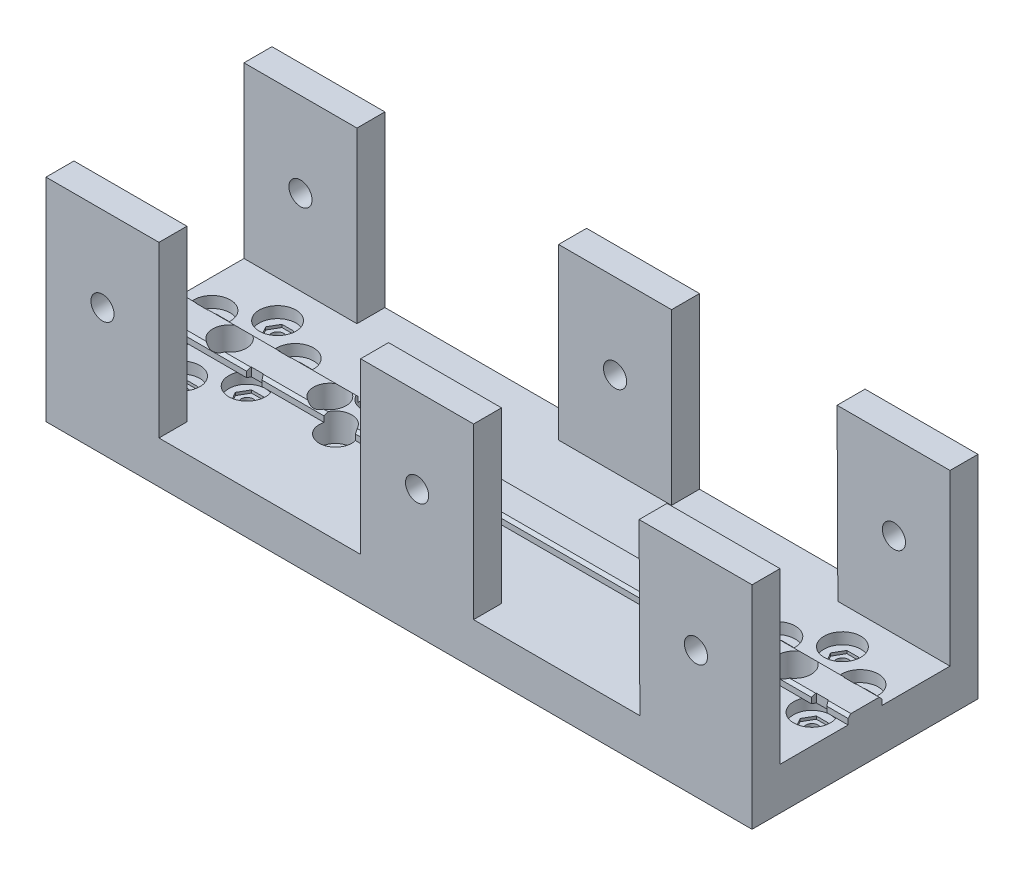
from build123d import *

# Parameters (mm, degrees)
SKETCH1_W                = 250
SKETCH1_H                = 60
SKETCH1_R                = 2.2
BOSS_EXTRUDE1_DEPTH      = 15
BOSS_EXTRUDE2_START      = 15
SKETCH2_W                = 250
SKETCH2_H                = 12
BOSS_EXTRUDE2_DEPTH      = 3
CHAMFER1_SIZE            = 1
CUT_EXTRUDE1_START       = 18
CUT_EXTRUDE1_DEPTH       = 8
CUT_EXTRUDE2_START       = 15
SKETCH4_R                = 6.5
CUT_EXTRUDE2_DEPTH       = 4
CUT_EXTRUDE3_DEPTH       = 258.728539359
CUT_EXTRUDE3_DEPTH_BACK  = 258.728539359
SKETCH5_R                = 3
CUT_EXTRUDE7_START       = 18
SKETCH6_R                = 5.75
CUT_EXTRUDE7_DEPTH       = 10
CUT_EXTRUDE13_DEPTH      = 258.728539359
CUT_EXTRUDE13_DEPTH_BACK = 258.728539359
SKETCH7_R                = 5.95
SKETCH9_R                = 4.1
BOSS_EXTRUDE3_DEPTH      = 10
BOSS_EXTRUDE4_START      = -70
SKETCH9_3_R              = 4.1
BOSS_EXTRUDE4_DEPTH      = 10
SKETCH11_W               = 250
SKETCH11_H               = 60
CUT_EXTRUDE14_DEPTH      = 0.1
CUT_EXTRUDE15_START      = -60.1
SKETCH11_2_W             = 250
SKETCH11_2_H             = 60
CUT_EXTRUDE15_DEPTH      = 0.1


with BuildPart() as part:
    # Sketch1 → Boss-Extrude1 (new body)
    with BuildSketch(Plane(origin=(0, 0, 0), x_dir=(1, 0, 0), z_dir=(0, 1, 0))):
        with Locations((125, 30)):
            Rectangle(SKETCH1_W, SKETCH1_H)
        with Locations(Location((25, 13, 0), (0, 0, 270))):
            Circle(SKETCH1_R, mode=Mode.SUBTRACT)
        with Locations(Location((10.277568136, 21.5, 0), (0, 0, 270))):
            Circle(SKETCH1_R, mode=Mode.SUBTRACT)
        with Locations(Location((10.277568136, 38.5, 0), (0, 0, 270))):
            Circle(SKETCH1_R, mode=Mode.SUBTRACT)
        with Locations(Location((25, 47, 0), (0, 0, 270))):
            Circle(SKETCH1_R, mode=Mode.SUBTRACT)
        with Locations(Location((39.722431864, 38.5, 0), (0, 0, 270))):
            Circle(SKETCH1_R, mode=Mode.SUBTRACT)
        with Locations(Location((39.722431864, 21.5, 0), (0, 0, 270))):
            Circle(SKETCH1_R, mode=Mode.SUBTRACT)
        with Locations(Location((210.277568136, 21.5, 0), (0, 0, 90))):
            Circle(SKETCH1_R, mode=Mode.SUBTRACT)
        with Locations(Location((210.277568136, 38.5, 0), (0, 0, 90))):
            Circle(SKETCH1_R, mode=Mode.SUBTRACT)
        with Locations(Location((225, 47, 0), (0, 0, 90))):
            Circle(SKETCH1_R, mode=Mode.SUBTRACT)
        with Locations(Location((239.722431864, 38.5, 0), (0, 0, 90))):
            Circle(SKETCH1_R, mode=Mode.SUBTRACT)
        with Locations(Location((239.722431864, 21.5, 0), (0, 0, 90))):
            Circle(SKETCH1_R, mode=Mode.SUBTRACT)
        with Locations(Location((225, 13, 0), (0, 0, 90))):
            Circle(SKETCH1_R, mode=Mode.SUBTRACT)
    extrude(amount=BOSS_EXTRUDE1_DEPTH)

    # Sketch2 → Boss-Extrude2 (add)
    with BuildSketch(Plane(origin=(0, 0, 0), x_dir=(1, 0, 0), z_dir=(0, 1, 0)).offset(BOSS_EXTRUDE2_START)):
        with Locations((125, 30)):
            Rectangle(SKETCH2_W, SKETCH2_H)
    extrude(amount=BOSS_EXTRUDE2_DEPTH)

    # Chamfer1
    chamfer1_edges = [part.edges().sort_by_distance(p)[0] for p in [
        (125, 18, -36),
        (125, 18, -24),
    ]]
    chamfer(chamfer1_edges, length=CHAMFER1_SIZE)

    # Sketch3 → Cut-Extrude1 (cut)
    with BuildSketch(Plane(origin=(0, 0, 0), x_dir=(1, 0, 0), z_dir=(0, 1, 0)).offset(CUT_EXTRUDE1_START)):
        Polygon((29.2, 13), (27.1, 16.637306696), (22.9, 16.637306696), (20.8, 13), (22.9, 9.362693304), (27.1, 9.362693304), align=None)
        Polygon((29.2, 47), (27.1, 50.637306696), (22.9, 50.637306696), (20.8, 47), (22.9, 43.362693304), (27.1, 43.362693304), align=None)
        Polygon((43.922431864, 38.5), (41.822431864, 42.137306696), (37.622431864, 42.137306696), (35.522431864, 38.5), (37.622431864, 34.862693304), (41.822431864, 34.862693304), align=None)
        Polygon((43.922431864, 21.5), (41.822431864, 25.137306696), (37.622431864, 25.137306696), (35.522431864, 21.5), (37.622431864, 17.862693304), (41.822431864, 17.862693304), align=None)
        Polygon((14.477568136, 21.5), (12.377568136, 25.137306696), (8.177568136, 25.137306696), (6.077568136, 21.5), (8.177568136, 17.862693304), (12.377568136, 17.862693304), align=None)
        Polygon((14.477568136, 38.5), (12.377568136, 42.137306696), (8.177568136, 42.137306696), (6.077568136, 38.5), (8.177568136, 34.862693304), (12.377568136, 34.862693304), align=None)
        Polygon((237.622431864, 34.862693304), (235.522431864, 38.5), (237.622431864, 42.137306696), (241.822431864, 42.137306696), (243.922431864, 38.5), (241.822431864, 34.862693304), align=None)
        Polygon((237.622431864, 17.862693304), (235.522431864, 21.5), (237.622431864, 25.137306696), (241.822431864, 25.137306696), (243.922431864, 21.5), (241.822431864, 17.862693304), align=None)
        Polygon((208.177568136, 17.862693304), (206.077568136, 21.5), (208.177568136, 25.137306696), (212.377568136, 25.137306696), (214.477568136, 21.5), (212.377568136, 17.862693304), align=None)
        Polygon((208.177568136, 34.862693304), (206.077568136, 38.5), (208.177568136, 42.137306696), (212.377568136, 42.137306696), (214.477568136, 38.5), (212.377568136, 34.862693304), align=None)
        Polygon((222.9, 43.362693304), (220.8, 47), (222.9, 50.637306696), (227.1, 50.637306696), (229.2, 47), (227.1, 43.362693304), align=None)
        Polygon((222.9, 9.362693304), (220.8, 13), (222.9, 16.637306696), (227.1, 16.637306696), (229.2, 13), (227.1, 9.362693304), align=None)
    extrude(amount=-CUT_EXTRUDE1_DEPTH, mode=Mode.SUBTRACT)

    # Sketch4 → Cut-Extrude2 (cut)
    with BuildSketch(Plane(origin=(0, 0, 0), x_dir=(1, 0, 0), z_dir=(0, 1, 0)).offset(CUT_EXTRUDE2_START)):
        with Locations(Location((25, 13, 0), (0, 0, 90))):
            Circle(SKETCH4_R)
        with Locations(Location((10.277568136, 21.5, 0), (0, 0, 22.619864948))):
            Circle(SKETCH4_R)
        with Locations(Location((39.722431864, 21.5, 0), (0, 0, 157.380135052))):
            Circle(SKETCH4_R)
        with Locations(Location((39.722431864, 38.5, 0), (0, 0, 337.380135052))):
            Circle(SKETCH4_R)
        with Locations(Location((25, 47, 0), (0, 0, 90))):
            Circle(SKETCH4_R)
        with Locations(Location((10.277568136, 38.5, 0), (0, 0, 202.619864948))):
            Circle(SKETCH4_R)
        with Locations(Location((239.722431864, 38.5, 0), (0, 0, 202.619864948))):
            Circle(SKETCH4_R)
        with Locations(Location((225, 47, 0), (0, 0, 90))):
            Circle(SKETCH4_R)
        with Locations(Location((210.277568136, 38.5, 0), (0, 0, 202.619864948))):
            Circle(SKETCH4_R)
        with Locations(Location((210.277568136, 21.5, 0), (0, 0, 22.619864948))):
            Circle(SKETCH4_R)
        with Locations(Location((239.722431864, 21.5, 0), (0, 0, 22.619864948))):
            Circle(SKETCH4_R)
        with Locations(Location((225, 13, 0), (0, 0, 90))):
            Circle(SKETCH4_R)
    extrude(amount=-CUT_EXTRUDE2_DEPTH, mode=Mode.SUBTRACT)

    # Sketch5 → Cut-Extrude3 (cut, two sides: drawn at the far end of the back side and taken through both)
    with BuildSketch(Plane(origin=(0, 0, 0), x_dir=(1, 0, 0), z_dir=(0, 1, 0)).offset(-CUT_EXTRUDE3_DEPTH_BACK)):
        with Locations(Location((60.5, 30, 0), (0, 0, 90))):
            Circle(SKETCH5_R)
        with Locations(Location((70, 22.5, 0), (0, 0, 90))):
            Circle(SKETCH5_R)
        with Locations(Location((70, 37.5, 0), (0, 0, 90))):
            Circle(SKETCH5_R)
        with Locations(Location((79.5, 30, 0), (0, 0, 90))):
            Circle(SKETCH5_R)
    extrude(amount=CUT_EXTRUDE3_DEPTH + CUT_EXTRUDE3_DEPTH_BACK, mode=Mode.SUBTRACT)

    # Sketch6 → Cut-Extrude7 (cut)
    with BuildSketch(Plane(origin=(0, 0, 0), x_dir=(1, 0, 0), z_dir=(0, 1, 0)).offset(CUT_EXTRUDE7_START)):
        with Locations(Location((60.5, 30, 0), (0, 0, 270))):
            Circle(SKETCH6_R)
        with Locations(Location((70, 37.5, 0), (0, 0, 270))):
            Circle(SKETCH6_R)
        with Locations(Location((79.5, 30, 0), (0, 0, 270))):
            Circle(SKETCH6_R)
        with Locations(Location((70, 22.5, 0), (0, 0, 270))):
            Circle(SKETCH6_R)
    extrude(amount=-CUT_EXTRUDE7_DEPTH, mode=Mode.SUBTRACT)

    # Sketch7 → Cut-Extrude13 (cut, two sides: drawn at the far end of the back side and taken through both)
    with BuildSketch(Plane(origin=(0, 0, 0), x_dir=(1, 0, 0), z_dir=(0, 1, 0)).offset(-CUT_EXTRUDE13_DEPTH_BACK)):
        with Locations(Location((225, 30, 0), (0, 0, 122.824368373))):
            Circle(SKETCH7_R)
        with Locations(Location((25, 30, 0), (0, 0, 122.824368373))):
            Circle(SKETCH7_R)
    extrude(amount=CUT_EXTRUDE13_DEPTH + CUT_EXTRUDE13_DEPTH_BACK, mode=Mode.SUBTRACT)

    # Sketch9 → Boss-Extrude3 (add)
    with BuildSketch(Plane.XY):
        Polygon((0, 0), (250, 0), (250, 75), (210, 75), (210.277568136, 15), (151.394941002, 15), (151.394941002, 75), (111.394941002, 75), (111.394941002, 15), (40, 15), (40, 75), (0, 75), align=None)
        with Locations((20, 45)):
            Circle(SKETCH9_R, mode=Mode.SUBTRACT)
        with Locations((131.394941002, 45)):
            Circle(SKETCH9_R, mode=Mode.SUBTRACT)
        with Locations((230.138998078, 45)):
            Circle(SKETCH9_R, mode=Mode.SUBTRACT)
    extrude(amount=BOSS_EXTRUDE3_DEPTH)

    # Sketch9<3> → Boss-Extrude4 (add)
    with BuildSketch(Plane.XY.offset(BOSS_EXTRUDE4_START)):
        Polygon((0, 0), (250, 0), (250, 75), (210, 75), (210.277568136, 15), (151.394941002, 15), (151.394941002, 75), (111.394941002, 75), (111.394941002, 15), (40, 15), (40, 75), (0, 75), align=None)
        with Locations((20, 45)):
            Circle(SKETCH9_3_R, mode=Mode.SUBTRACT)
        with Locations((131.394941002, 45)):
            Circle(SKETCH9_3_R, mode=Mode.SUBTRACT)
        with Locations((230.138998078, 45)):
            Circle(SKETCH9_3_R, mode=Mode.SUBTRACT)
    extrude(amount=BOSS_EXTRUDE4_DEPTH)

    # Sketch11 → Cut-Extrude14 (cut)
    with BuildSketch(Plane.XY):
        with Locations((125, 45)):
            Rectangle(SKETCH11_W, SKETCH11_H)
    extrude(amount=CUT_EXTRUDE14_DEPTH, mode=Mode.SUBTRACT)

    # Sketch11<2> → Cut-Extrude15 (cut)
    with BuildSketch(Plane.XY.offset(CUT_EXTRUDE15_START)):
        with Locations((125, 45)):
            Rectangle(SKETCH11_2_W, SKETCH11_2_H)
    extrude(amount=CUT_EXTRUDE15_DEPTH, mode=Mode.SUBTRACT)


solid = part.part
